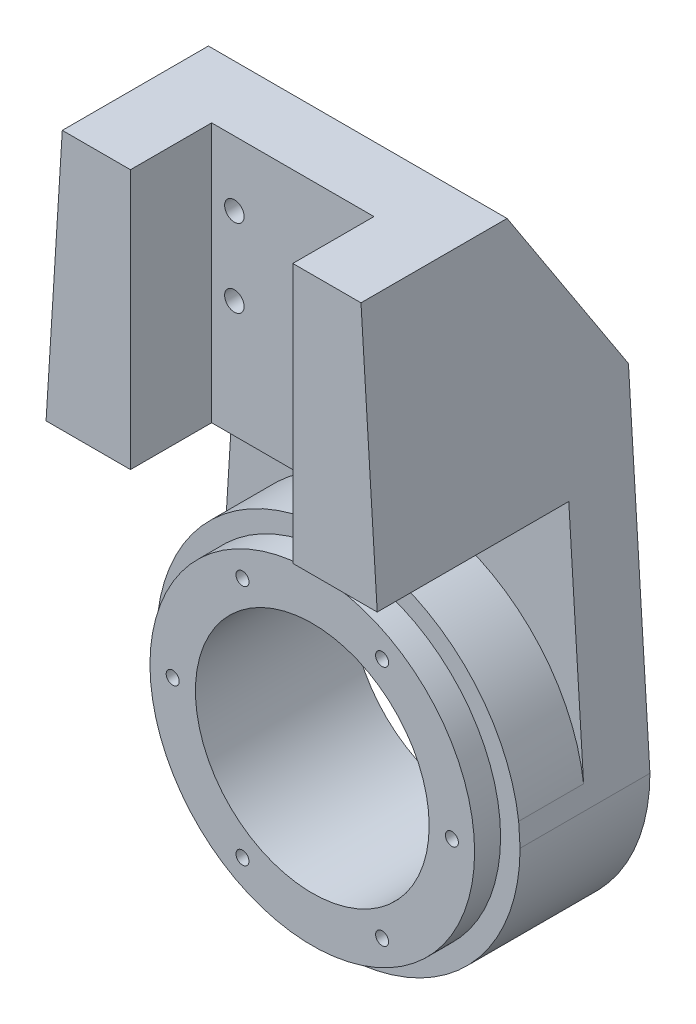
from build123d import *

# Parameters (mm, degrees)
SKETCH1_R               = 28
SKETCH1_R_2             = 18
BOSS_EXTRUDE1_DEPTH     = 10
SKETCH5_R               = 28
SKETCH5_R_2             = 18
BOSS_EXTRUDE6_DEPTH     = 10
SKETCH6_R               = 25
SKETCH6_R_2             = 18
BOSS_EXTRUDE7_DEPTH     = 4
SKETCH7_R               = 1
CUT_EXTRUDE1_DEPTH      = 24
SKETCH8_W               = 56
SKETCH8_H               = 40
BOSS_EXTRUDE8_DEPTH     = 29.5
SKETCH9_W               = 25
SKETCH9_H               = 12.5
CUT_EXTRUDE2_DEPTH      = 45
SKETCH10_W              = 12
SKETCH10_H              = 17
CUT_EXTRUDE3_DEPTH      = 27
CUT_EXTRUDE4_DEPTH      = 42
CUT_EXTRUDE4_DEPTH_BACK = 16
CUT_EXTRUDE5_DEPTH      = 40
SKETCH14_R              = 1.5
CUT_EXTRUDE6_DEPTH      = 10


with BuildPart() as part:
    # Sketch1 → Boss-Extrude1 (new body)
    # profile 1 of 2: a face of its own
    with BuildSketch(Plane.XY):
        Circle(SKETCH1_R)
        Circle(SKETCH1_R_2, mode=Mode.SUBTRACT)
    # profile 2 of 2: a face of its own
    with BuildSketch(Plane.XY):
        with BuildLine():
            Line((-28, 80), (28, 80))
            Line((28, 80), (28, 0))
            ThreePointArc((28, 0), (0, 28), (-28, 0))
            Line((-28, 0), (-28, 80))
        make_face()
    extrude(amount=BOSS_EXTRUDE1_DEPTH)

    # Sketch5 → Boss-Extrude6 (add)
    with BuildSketch(Plane.XY.offset(10)):
        Circle(SKETCH5_R)
        Circle(SKETCH5_R_2, mode=Mode.SUBTRACT)
    extrude(amount=BOSS_EXTRUDE6_DEPTH)

    # Sketch6 → Boss-Extrude7 (add)
    with BuildSketch(Plane.XY.offset(20)):
        Circle(SKETCH6_R)
        Circle(SKETCH6_R_2, mode=Mode.SUBTRACT)
    extrude(amount=BOSS_EXTRUDE7_DEPTH)

    # Sketch7 → Cut-Extrude1 (cut)
    with BuildSketch(Plane.XY.offset(24)):
        with Locations((-10.75, 18.619546181)):
            Circle(SKETCH7_R)
        with Locations((10.75, 18.619546181)):
            Circle(SKETCH7_R)
        with Locations((21.5, 0)):
            Circle(SKETCH7_R)
        with Locations((10.75, -18.619546181)):
            Circle(SKETCH7_R)
        with Locations((-10.75, -18.619546181)):
            Circle(SKETCH7_R)
        with Locations((-21.5, 0)):
            Circle(SKETCH7_R)
    extrude(amount=-CUT_EXTRUDE1_DEPTH, mode=Mode.SUBTRACT)

    # Sketch8 → Boss-Extrude8 (add)
    with BuildSketch(Plane.XY.offset(10)):
        with Locations((0, 60)):
            Rectangle(SKETCH8_W, SKETCH8_H)
    extrude(amount=BOSS_EXTRUDE8_DEPTH)

    # Sketch9 → Cut-Extrude2 (cut)
    with BuildSketch(Plane(origin=(0, 80, 0), x_dir=(1, 0, 0), z_dir=(0, 1, 0))):
        with Locations((0, -33.25)):
            Rectangle(SKETCH9_W, SKETCH9_H)
    extrude(amount=-CUT_EXTRUDE2_DEPTH, mode=Mode.SUBTRACT)

    # Sketch10 → Cut-Extrude3 (cut)
    with BuildSketch(Plane(origin=(0, 80, 0), x_dir=(1, 0, 0), z_dir=(0, 1, 0))):
        with Locations((11, -8.5)):
            Rectangle(SKETCH10_W, SKETCH10_H)
        with Locations((-11, -8.5)):
            Rectangle(SKETCH10_W, SKETCH10_H)
    extrude(amount=-CUT_EXTRUDE3_DEPTH, mode=Mode.SUBTRACT)

    # Sketch11 → Cut-Extrude4 (cut, two sides: drawn at the far end of the back side and taken through both)
    with BuildSketch(Plane.ZY.offset(-17).offset(-CUT_EXTRUDE4_DEPTH_BACK)):
        Polygon((0, 53), (17, 80), (0, 80), align=None)
    extrude(amount=CUT_EXTRUDE4_DEPTH + CUT_EXTRUDE4_DEPTH_BACK, mode=Mode.SUBTRACT)

    # Sketch13 → Cut-Extrude5 (cut)
    with BuildSketch(Plane(origin=(0, 0, 0), x_dir=(-1, 0, 0), z_dir=(0, 0, -1))):
        Polygon((28, 80), (28, 0), (23, 80), align=None)
    cut_extrude5 = extrude(amount=-CUT_EXTRUDE5_DEPTH, mode=Mode.SUBTRACT)

    # Mirror1: Cut-Extrude5 across plane
    add(cut_extrude5.mirror(Plane(origin=(0, 0, 0), x_dir=(0, 0, 1), z_dir=(1, 0, 0))), mode=Mode.SUBTRACT)

    # Sketch14 → Cut-Extrude6 (cut)
    with BuildSketch(Plane(origin=(0, 0, 17), x_dir=(-1, 0, 0), z_dir=(0, 0, -1))):
        with Locations((-9, 70)):
            Circle(SKETCH14_R)
        with Locations((-9, 58)):
            Circle(SKETCH14_R)
        with Locations((9, 70)):
            Circle(SKETCH14_R)
        with Locations((9, 58)):
            Circle(SKETCH14_R)
    extrude(amount=-CUT_EXTRUDE6_DEPTH, mode=Mode.SUBTRACT)


solid = part.part
